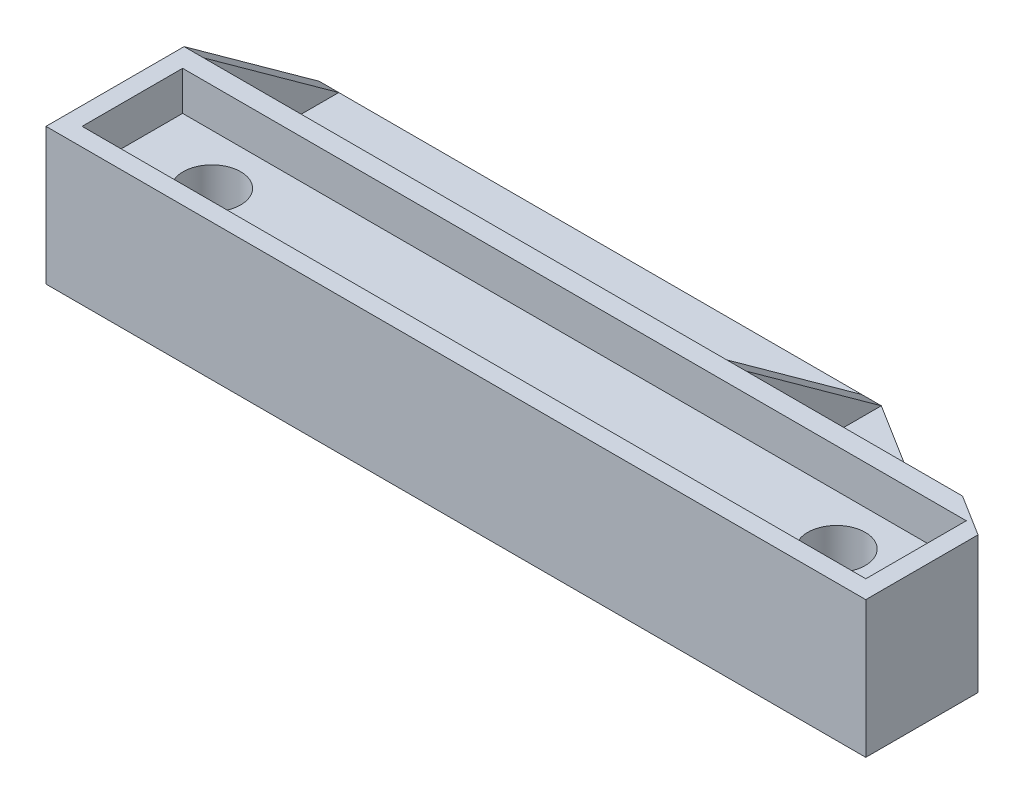
from build123d import *

# Parameters (mm, degrees)
RISER_DEPTH             = 7
SKETCH2_R               = 1.475
MOUNTING_HOLES_DEPTH    = 44.150898021
SKETCH3_W               = 40.15
SKETCH3_H               = 5.15
RECESS_DEPTH            = 2
FLANGE_DEPTH            = 7
SKETCH5_W               = 26.797240136
SKETCH5_H               = 6.925
FLANGE_CUTOUT_DEPTH     = 5
ANGLE_CUTOUT_DEPTH      = 32.901199964
ANGLE_CUTOUT_DEPTH_BACK = 32.901199964
FLANGE_CHAMFER_1_SIZE   = 1
FLANGE_CHAMFER_2_SIZE   = 1


with BuildPart() as part:
    # Sketch1 → Riser (new body)
    with BuildSketch(Plane(origin=(0, 0, 0), x_dir=(1, 0, 0), z_dir=(0, 1, 0))):
        Polygon((39.999581839, 7), (42, 5.75), (42, 0), (0, 0), (0, 7), align=None)
    extrude(amount=RISER_DEPTH)

    # Sketch2 → Mounting Holes (cut, through all)
    with BuildSketch(Plane.XZ):
        with Locations(Location((5, -3.5, 0), (0, 0, 90))):
            Circle(SKETCH2_R)
        with Locations(Location((37, -3.5, 0), (0, 0, 270))):
            Circle(SKETCH2_R)
    extrude(amount=-MOUNTING_HOLES_DEPTH, mode=Mode.SUBTRACT)

    # Sketch3 → Recess (cut)
    with BuildSketch(Plane(origin=(0, 7, 0), x_dir=(1, 0, 0), z_dir=(0, 1, 0))):
        with Locations((21, 3.5)):
            Rectangle(SKETCH3_W, SKETCH3_H)
    extrude(amount=-RECESS_DEPTH, mode=Mode.SUBTRACT)

    # Sketch4 → Flange (add)
    with BuildSketch(Plane(origin=(0, 0, 0), x_dir=(1, 0, 0), z_dir=(0, 1, 0))):
        Polygon((0, 7), (39.999581839, 7), (28.797240136, 14), (0, 14), align=None)
    extrude(amount=FLANGE_DEPTH)

    # Sketch5 → Flange Cutout (cut)
    with BuildSketch(Plane(origin=(0, 7, 0), x_dir=(1, 0, 0), z_dir=(0, 1, 0))):
        with Locations((14.398620068, 10.5375)):
            Rectangle(SKETCH5_W, SKETCH5_H)
        Polygon((28.797240136, 14), (28.797240136, 7.075), (39.879556749, 7.075), align=None)
    extrude(amount=-FLANGE_CUTOUT_DEPTH, mode=Mode.SUBTRACT)

    # Sketch7 → Angle Cutout (cut, two sides: drawn at the far end of the back side and taken through both)
    with BuildSketch(Plane.ZY.offset(-27.797240136).offset(-ANGLE_CUTOUT_DEPTH_BACK)):
        Polygon((-7.075, 7), (-14, 2), (-14, 7), align=None)
    extrude(amount=ANGLE_CUTOUT_DEPTH + ANGLE_CUTOUT_DEPTH_BACK, mode=Mode.SUBTRACT)

    # Flange Chamfer 1
    flange_chamfer_1_edges = [part.edges().sort_by_distance(p)[0] for p in [
        (14.398620068, 2, -7.075),
    ]]
    chamfer(flange_chamfer_1_edges, length=FLANGE_CHAMFER_1_SIZE)

    # Flange Chamfer 2
    flange_chamfer_2_edges = [part.edges().sort_by_distance(p)[0] for p in [
        (34.338398442, 2, -7.075),
    ]]
    chamfer(flange_chamfer_2_edges, length=FLANGE_CHAMFER_2_SIZE)


solid = part.part
